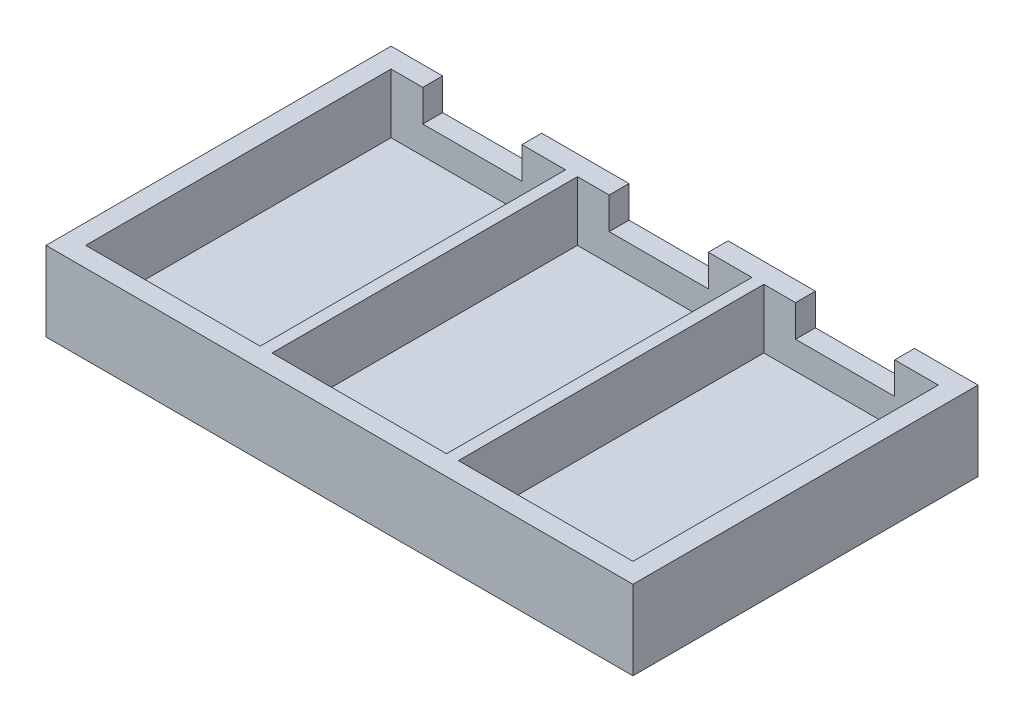
from build123d import *

# Parameters (mm, degrees)
SKETCH1_W           = 148
SKETCH1_H           = 87
BOSS_EXTRUDE1_DEPTH = 20
SHELL1_T            = -5
BOSS_EXTRUDE2_REACH = 157.551
SKETCH2_W           = 3
SKETCH2_H           = 77
SKETCH3_W           = 25
SKETCH3_H           = 5
CUT_EXTRUDE1_DEPTH  = 8


with BuildPart() as part:
    # Sketch1 → Boss-Extrude1 (new body)
    with BuildSketch(Plane(origin=(0, 0, 0), x_dir=(1, 0, 0), z_dir=(0, 1, 0))):
        with Locations((74, 0)):
            Rectangle(SKETCH1_W, SKETCH1_H)
    extrude(amount=BOSS_EXTRUDE1_DEPTH)

    # Shell1
    shell1_openings = [part.faces().sort_by_distance(p)[0] for p in [
        (74, 20, 0),
    ]]
    offset(amount=SHELL1_T, openings=shell1_openings, kind=Kind.INTERSECTION)

    # Sketch2 → Boss-Extrude2 (add, up to next)
    with BuildSketch(Plane(origin=(0, 20, 0), x_dir=(1, 0, 0), z_dir=(0, 1, 0)), mode=Mode.PRIVATE) as boss_extrude2_sk1:
        with Locations((50.5, 0)):
            Rectangle(SKETCH2_W, SKETCH2_H)
    boss_extrude2_tool1 = extrude(boss_extrude2_sk1.sketch, amount=-BOSS_EXTRUDE2_REACH, mode=Mode.PRIVATE) - part.part
    # Sketch2 → Boss-Extrude2 (add, up to next)
    with BuildSketch(Plane(origin=(0, 20, 0), x_dir=(1, 0, 0), z_dir=(0, 1, 0)), mode=Mode.PRIVATE) as boss_extrude2_sk2:
        with Locations((97.5, 0)):
            Rectangle(SKETCH2_W, SKETCH2_H)
    boss_extrude2_tool2 = extrude(boss_extrude2_sk2.sketch, amount=-BOSS_EXTRUDE2_REACH, mode=Mode.PRIVATE) - part.part
    add(boss_extrude2_tool1.solids().sort_by_distance((50.5, 20, 0))[0])
    add(boss_extrude2_tool2.solids().sort_by_distance((97.5, 20, 0))[0])

    # Sketch3 → Cut-Extrude1 (cut)
    with BuildSketch(Plane(origin=(0, 20, 0), x_dir=(1, 0, 0), z_dir=(0, 1, 0))):
        with Locations((25.5, 41)):
            Rectangle(SKETCH3_W, SKETCH3_H)
        with Locations((72.5, 41)):
            Rectangle(SKETCH3_W, SKETCH3_H)
        with Locations((119.5, 41)):
            Rectangle(SKETCH3_W, SKETCH3_H)
    extrude(amount=-CUT_EXTRUDE1_DEPTH, mode=Mode.SUBTRACT)


solid = part.part
